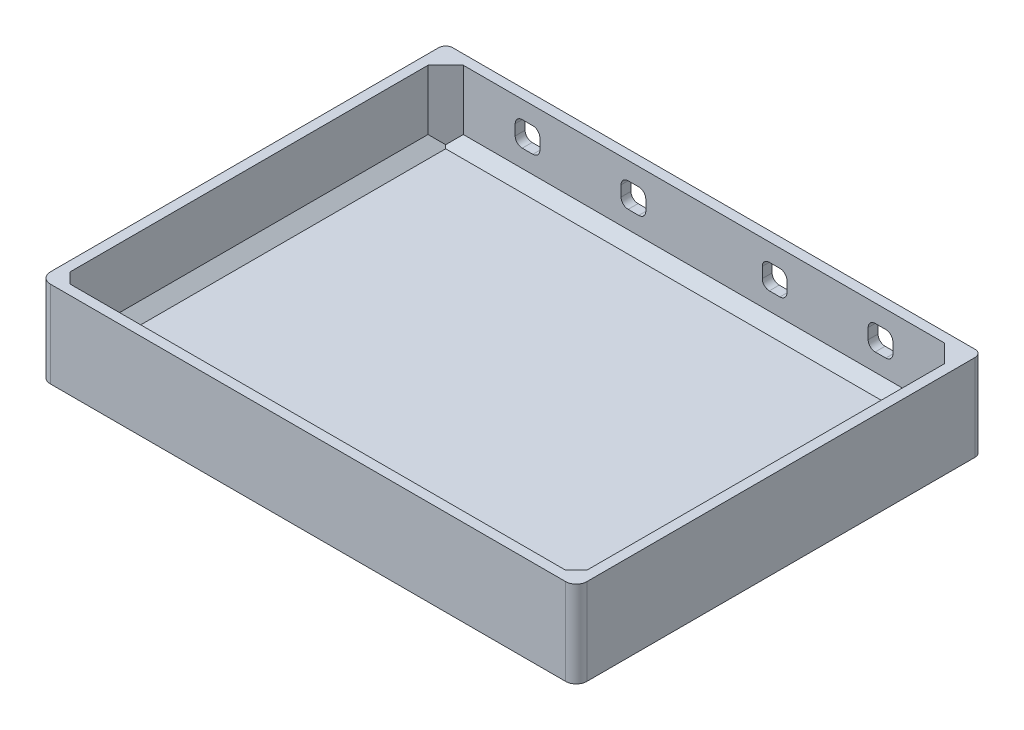
from build123d import *

# Parameters (mm, degrees)
ESBO_O2_W             = 152
ESBO_O2_H             = 115
BASE_DEPTH            = 4.5
ESBO_O3_W             = 152
ESBO_O3_H             = 115
ESBO_O3_W_2           = 146.4
ESBO_O3_H_2           = 109.4
PAREDES_DEPTH         = 20
CHANFRO_DA_BASE_SIZE  = 3
FILETE7_R             = 3
FILETE8_R             = 3
FILETE10_R            = 2
FILETE12_R            = 2
CHANFRO8_SIZE         = 3
CHANFRO9_SIZE         = 3
CHANFRO14_SIZE        = 5
CHANFRO17_SIZE        = 5
CORTE_EXTRUS_O4_DEPTH = 10


with BuildPart() as part:
    # Esboço2 → Base (new body)
    with BuildSketch(Plane(origin=(0, 0, 0), x_dir=(1, 0, 0), z_dir=(0, 1, 0))):
        Rectangle(ESBO_O2_W, ESBO_O2_H)
    extrude(amount=BASE_DEPTH)

    # Esboço3 → Paredes (add)
    with BuildSketch(Plane(origin=(0, 4.5, 0), x_dir=(1, 0, 0), z_dir=(0, 1, 0))):
        Rectangle(ESBO_O3_W, ESBO_O3_H)
        Rectangle(ESBO_O3_W_2, ESBO_O3_H_2, mode=Mode.SUBTRACT)
    extrude(amount=PAREDES_DEPTH)

    # Chanfro da Base
    chanfro_da_base_edges = [part.edges().sort_by_distance(p)[0] for p in [
        (0, 4.5, -54.7),
        (-73.2, 4.5, 0),
        (0, 4.5, 54.7),
        (73.2, 4.5, 0),
    ]]
    chamfer(chanfro_da_base_edges, length=CHANFRO_DA_BASE_SIZE)

    # Filete7
    filete7_edges = [part.edges().sort_by_distance(p)[0] for p in [
        (-76, 12.25, 57.5),
    ]]
    fillet(filete7_edges, radius=FILETE7_R)

    # Filete8
    filete8_edges = [part.edges().sort_by_distance(p)[0] for p in [
        (76, 12.25, 57.5),
    ]]
    fillet(filete8_edges, radius=FILETE8_R)

    # Filete10
    filete10_edges = [part.edges().sort_by_distance(p)[0] for p in [
        (-76, 12.25, -57.5),
    ]]
    fillet(filete10_edges, radius=FILETE10_R)

    # Filete12
    filete12_edges = [part.edges().sort_by_distance(p)[0] for p in [
        (76, 12.25, -57.5),
    ]]
    fillet(filete12_edges, radius=FILETE12_R)

    # Chanfro8
    chanfro8_edges = [part.edges().sort_by_distance(p)[0] for p in [
        (-73.2, 16, 54.7),
    ]]
    chamfer(chanfro8_edges, length=CHANFRO8_SIZE)

    # Chanfro9
    chanfro9_edges = [part.edges().sort_by_distance(p)[0] for p in [
        (73.2, 16, 54.7),
    ]]
    chamfer(chanfro9_edges, length=CHANFRO9_SIZE)

    # Chanfro14
    chanfro14_edges = [part.edges().sort_by_distance(p)[0] for p in [
        (-73.2, 16, -54.7),
    ]]
    chamfer(chanfro14_edges, length=CHANFRO14_SIZE)

    # Chanfro17
    chanfro17_edges = [part.edges().sort_by_distance(p)[0] for p in [
        (73.2, 16, -54.7),
    ]]
    chamfer(chanfro17_edges, length=CHANFRO17_SIZE)

    # Esboço6 → Corte-extrusão4 (cut)
    with BuildSketch(Plane(origin=(0, 0, -57.5), x_dir=(-1, 0, 0), z_dir=(0, 0, -1))):
        with BuildLine():
            Line((16.5, 17.5), (16.5, 14.5))
            ThreePointArc((16.5, 14.5), (17.085786438, 13.085786438), (18.5, 12.5))
            Line((18.5, 12.5), (21.5, 12.5))
            ThreePointArc((21.5, 12.5), (22.914213562, 13.085786438), (23.5, 14.5))
            Line((23.5, 14.5), (23.5, 17.5))
            ThreePointArc((23.5, 17.5), (22.914213562, 18.914213562), (21.5, 19.5))
            Line((21.5, 19.5), (18.5, 19.5))
            ThreePointArc((18.5, 19.5), (17.085786438, 18.914213562), (16.5, 17.5))
        make_face()
        with BuildLine():
            Line((-21.5, 19.5), (-18.5, 19.5))
            ThreePointArc((-18.5, 19.5), (-17.085786438, 18.914213562), (-16.5, 17.5))
            Line((-16.5, 17.5), (-16.5, 14.5))
            ThreePointArc((-16.5, 14.5), (-17.085786438, 13.085786438), (-18.5, 12.5))
            Line((-18.5, 12.5), (-21.5, 12.5))
            ThreePointArc((-21.5, 12.5), (-22.914213562, 13.085786438), (-23.5, 14.5))
            Line((-23.5, 14.5), (-23.5, 17.5))
            ThreePointArc((-23.5, 17.5), (-22.914213562, 18.914213562), (-21.5, 19.5))
        make_face()
        with BuildLine():
            Line((46.5, 17.5), (46.5, 14.5))
            ThreePointArc((46.5, 14.5), (47.085786438, 13.085786438), (48.5, 12.5))
            Line((48.5, 12.5), (51.5, 12.5))
            ThreePointArc((51.5, 12.5), (52.914213562, 13.085786438), (53.5, 14.5))
            Line((53.5, 14.5), (53.5, 17.5))
            ThreePointArc((53.5, 17.5), (52.914213562, 18.914213562), (51.5, 19.5))
            Line((51.5, 19.5), (48.5, 19.5))
            ThreePointArc((48.5, 19.5), (47.085786438, 18.914213562), (46.5, 17.5))
        make_face()
        with BuildLine():
            Line((-51.5, 19.5), (-48.5, 19.5))
            ThreePointArc((-48.5, 19.5), (-47.085786438, 18.914213562), (-46.5, 17.5))
            Line((-46.5, 17.5), (-46.5, 14.5))
            ThreePointArc((-46.5, 14.5), (-47.085786438, 13.085786438), (-48.5, 12.5))
            Line((-48.5, 12.5), (-51.5, 12.5))
            ThreePointArc((-51.5, 12.5), (-52.914213562, 13.085786438), (-53.5, 14.5))
            Line((-53.5, 14.5), (-53.5, 17.5))
            ThreePointArc((-53.5, 17.5), (-52.914213562, 18.914213562), (-51.5, 19.5))
        make_face()
    extrude(amount=-CORTE_EXTRUS_O4_DEPTH, mode=Mode.SUBTRACT)


solid = part.part
